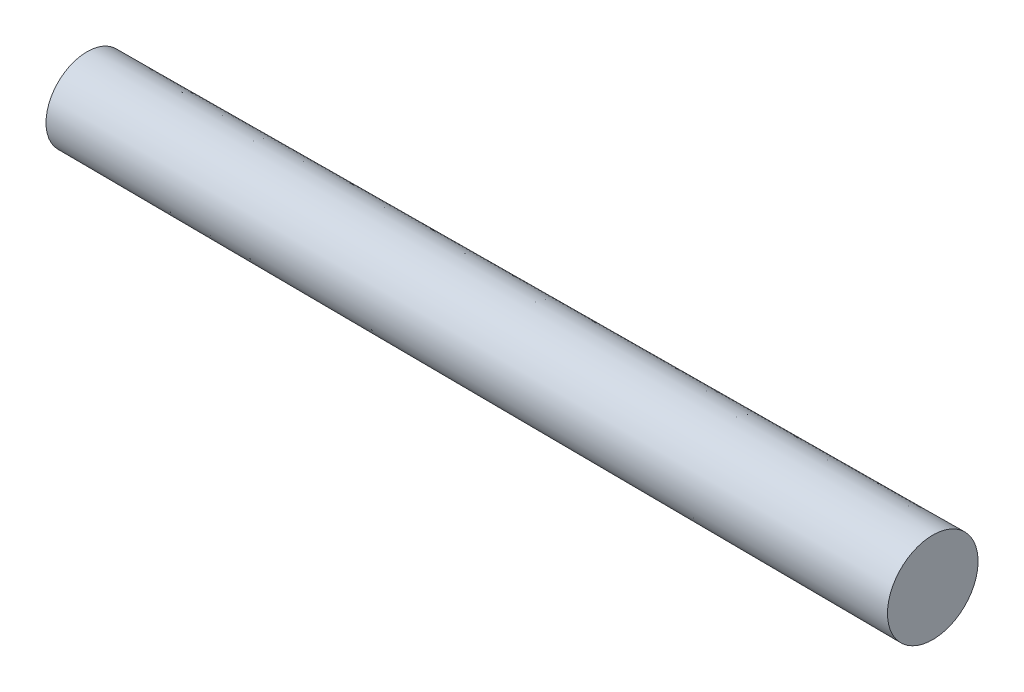
from build123d import *


with BuildPart() as part:
    # Sketch1 → Revolve1 (revolve)
    with BuildSketch(Plane.XY, mode=Mode.PRIVATE) as revolve1_sk:
        Polygon((0, 0), (56, 0), (56, 3), (0, 2.72), align=None)
    revolve(revolve1_sk.sketch.rotate(Axis((0, 0, 0), (1, 0, 0)), 90), axis=Axis((0, 0, 0), (1, 0, 0)))


solid = part.part
